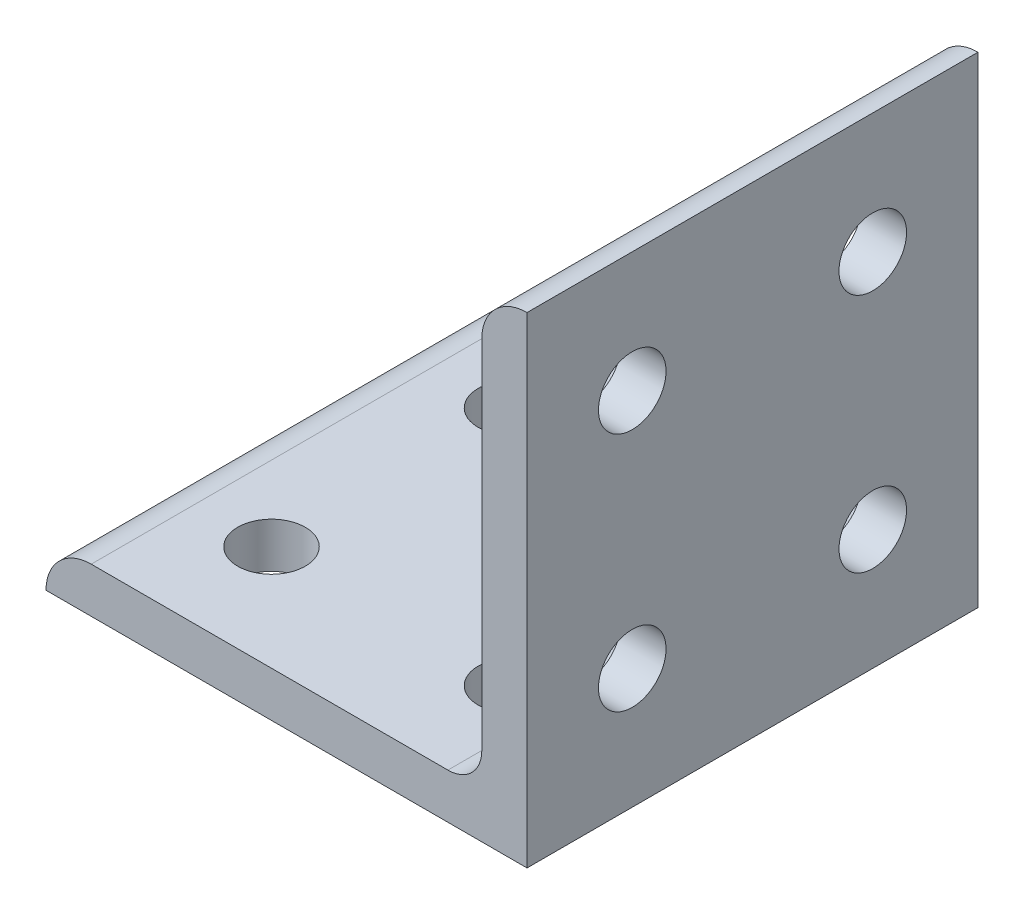
from build123d import *

# Parameters (mm, degrees)
EXTRUDE1_DEPTH     = 23.8125
SKETCH8_R          = 3.5687
CUT_EXTRUDE7_DEPTH = 73.566916507
SKETCH9_R          = 3.5687
CUT_EXTRUDE8_DEPTH = 73.566916507


with BuildPart() as part:
    # Sketch1 → Extrude1 (new, symmetric)
    with BuildSketch(Plane.XY):
        with BuildLine():
            Line((0, 0), (0, 50.8))
            ThreePointArc((0, 50.8), (-3.376576302, 49.401376302), (-4.7752, 46.0248))
            Line((-4.7752, 46.0248), (-4.7752, 8.3566))
            ThreePointArc((-4.7752, 8.3566), (-5.824167774, 5.824167774), (-8.3566, 4.7752))
            Line((-8.3566, 4.7752), (-46.0248, 4.7752))
            ThreePointArc((-46.0248, 4.7752), (-49.401376302, 3.376576302), (-50.8, 0))
            Line((-50.8, 0), (0, 0))
        make_face()
    extrude(amount=EXTRUDE1_DEPTH, both=True)

    # Sketch8 → Cut-Extrude7 (cut, through all)
    with BuildSketch(Plane(origin=(0, 4.7752, 0), x_dir=(1, 0, 0), z_dir=(0, 1, 0))):
        with Locations(Location((-38.1, -12.7, 0), (0, 0, 180))):
            Circle(SKETCH8_R)
        with Locations(Location((-12.7, -12.7, 0), (0, 0, 180))):
            Circle(SKETCH8_R)
        with Locations((-12.7, 12.7)):
            Circle(SKETCH8_R)
        with Locations((-38.1, 12.7)):
            Circle(SKETCH8_R)
    extrude(amount=-CUT_EXTRUDE7_DEPTH, mode=Mode.SUBTRACT)

    # Sketch9 → Cut-Extrude8 (cut, through all)
    with BuildSketch(Plane.ZY.offset(4.7752)):
        with Locations(Location((12.7, 12.7, 0), (0, 0, 270))):
            Circle(SKETCH9_R)
        with Locations(Location((12.7, 38.1, 0), (0, 0, 270))):
            Circle(SKETCH9_R)
        with Locations(Location((-12.7, 12.7, 0), (0, 0, 90))):
            Circle(SKETCH9_R)
        with Locations(Location((-12.7, 38.1, 0), (0, 0, 90))):
            Circle(SKETCH9_R)
    extrude(amount=-CUT_EXTRUDE8_DEPTH, mode=Mode.SUBTRACT)


solid = part.part
